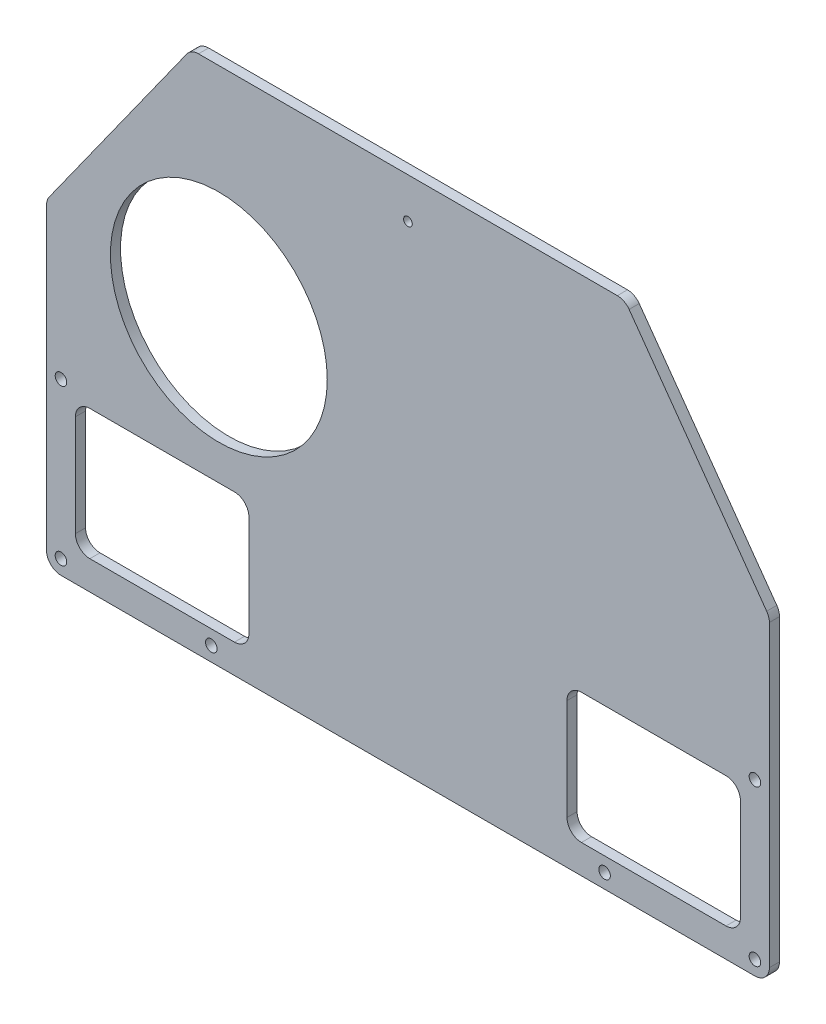
from build123d import *

# Parameters (mm, degrees)
BOSS_EXTRU_1_DEPTH           = 3.5
ESQUISSE2_R                  = 2
ENL_V_MAT_EXTRU_1_DEPTH      = 395.382111663
ESQUISSE3_R                  = 2
ENL_V_MAT_EXTRU_2_DEPTH      = 395.382111663
ENL_V_MAT_EXTRU_3_DEPTH      = 395.382111663
ENL_V_MAT_EXTRU_4_DEPTH      = 395.382111663
ENL_V_MAT_EXTRU_4_DEPTH_BACK = 395.382111663
ESQUISSE6_R                  = 1.5
ENL_V_MAT_EXTRU_5_DEPTH      = 309.078317965
CONG_1_R                     = 5
ESQUISSE7_R                  = 37.5
ENL_V_MAT_EXTRU_6_DEPTH      = 309.078317965


with BuildPart() as part:
    # Esquisse1 → Boss.-Extru.1 (new body)
    with BuildSketch(Plane.XY):
        with BuildLine():
            Line((5, 0), (245, 0))
            ThreePointArc((245, 0), (248.535533906, 1.464466094), (250, 5))
            Line((250, 5), (250, 305))
            Line((250, 305), (0, 305))
            Line((0, 305), (0, 5))
            ThreePointArc((0, 5), (1.464466094, 1.464466094), (5, 0))
        make_face()
    extrude(amount=BOSS_EXTRU_1_DEPTH)

    # Esquisse2 → Enlèv. mat.-Extru.1 (cut, through all)
    with BuildSketch(Plane.XY.offset(3.5)):
        with Locations((5, 5)):
            Circle(ESQUISSE2_R)
        with Locations((245, 5)):
            Circle(ESQUISSE2_R)
        with Locations((5, 58.8)):
            Circle(ESQUISSE2_R)
        with Locations((245, 58.8)):
            Circle(ESQUISSE2_R)
    extrude(amount=-ENL_V_MAT_EXTRU_1_DEPTH, mode=Mode.SUBTRACT)

    # Esquisse3 → Enlèv. mat.-Extru.2 (cut, through all)
    with BuildSketch(Plane.XY.offset(3.5)):
        with Locations((57, 5)):
            Circle(ESQUISSE3_R)
        with Locations((193, 5)):
            Circle(ESQUISSE3_R)
    extrude(amount=-ENL_V_MAT_EXTRU_2_DEPTH, mode=Mode.SUBTRACT)

    # Esquisse4 → Enlèv. mat.-Extru.3 (cut, through all)
    with BuildSketch(Plane(origin=(0, 0, 0), x_dir=(-1, 0, 0), z_dir=(0, 0, -1))):
        with BuildLine():
            Line((-70, 15), (-70, 50))
            ThreePointArc((-70, 50), (-68.535533906, 53.535533906), (-65, 55))
            Line((-65, 55), (-15, 55))
            ThreePointArc((-15, 55), (-11.464466094, 53.535533906), (-10, 50))
            Line((-10, 50), (-10, 15))
            ThreePointArc((-10, 15), (-11.464466094, 11.464466094), (-15, 10))
            Line((-15, 10), (-65, 10))
            ThreePointArc((-65, 10), (-68.535533906, 11.464466094), (-70, 15))
        make_face()
        with BuildLine():
            Line((-185, 10), (-235, 10))
            ThreePointArc((-235, 10), (-238.535533906, 11.464466094), (-240, 15))
            Line((-240, 15), (-240, 50))
            ThreePointArc((-240, 50), (-238.535533906, 53.535533906), (-235, 55))
            Line((-235, 55), (-185, 55))
            ThreePointArc((-185, 55), (-181.464466094, 53.535533906), (-180, 50))
            Line((-180, 50), (-180, 15))
            ThreePointArc((-180, 15), (-181.464466094, 11.464466094), (-185, 10))
        make_face()
    extrude(amount=-ENL_V_MAT_EXTRU_3_DEPTH, mode=Mode.SUBTRACT)

    # Esquisse5 → Enlèv. mat.-Extru.4 (cut, two sides: drawn at the far end of the back side and taken through both)
    with BuildSketch(Plane.XY.offset(3.5).offset(-ENL_V_MAT_EXTRU_4_DEPTH_BACK)):
        Polygon((-374.383398967, -414.136758554), (0, 110), (50, 180), (200, 180), (250, 110), (624.383398967, -414.136758554), (624.383398967, 874.090350445), (-374.383398967, 874.090350445), align=None)
    extrude(amount=ENL_V_MAT_EXTRU_4_DEPTH + ENL_V_MAT_EXTRU_4_DEPTH_BACK, mode=Mode.SUBTRACT)

    # Esquisse6 → Enlèv. mat.-Extru.5 (cut, through all)
    with BuildSketch(Plane.XY.offset(3.5)):
        with Locations((125, 166)):
            Circle(ESQUISSE6_R)
    extrude(amount=-ENL_V_MAT_EXTRU_5_DEPTH, mode=Mode.SUBTRACT)

    # Congé1
    cong_1_edges = [part.edges().sort_by_distance(p)[0] for p in [
        (50, 180, 1.75),
        (200, 180, 1.75),
        (250, 110, 1.75),
        (0, 110, 1.75),
    ]]
    fillet(cong_1_edges, radius=CONG_1_R)

    # Esquisse7 → Enlèv. mat.-Extru.6 (cut, through all)
    with BuildSketch(Plane.XY.offset(3.5)):
        with Locations((59.6, 104.646798594)):
            Circle(ESQUISSE7_R)
    extrude(amount=-ENL_V_MAT_EXTRU_6_DEPTH, mode=Mode.SUBTRACT)


solid = part.part
